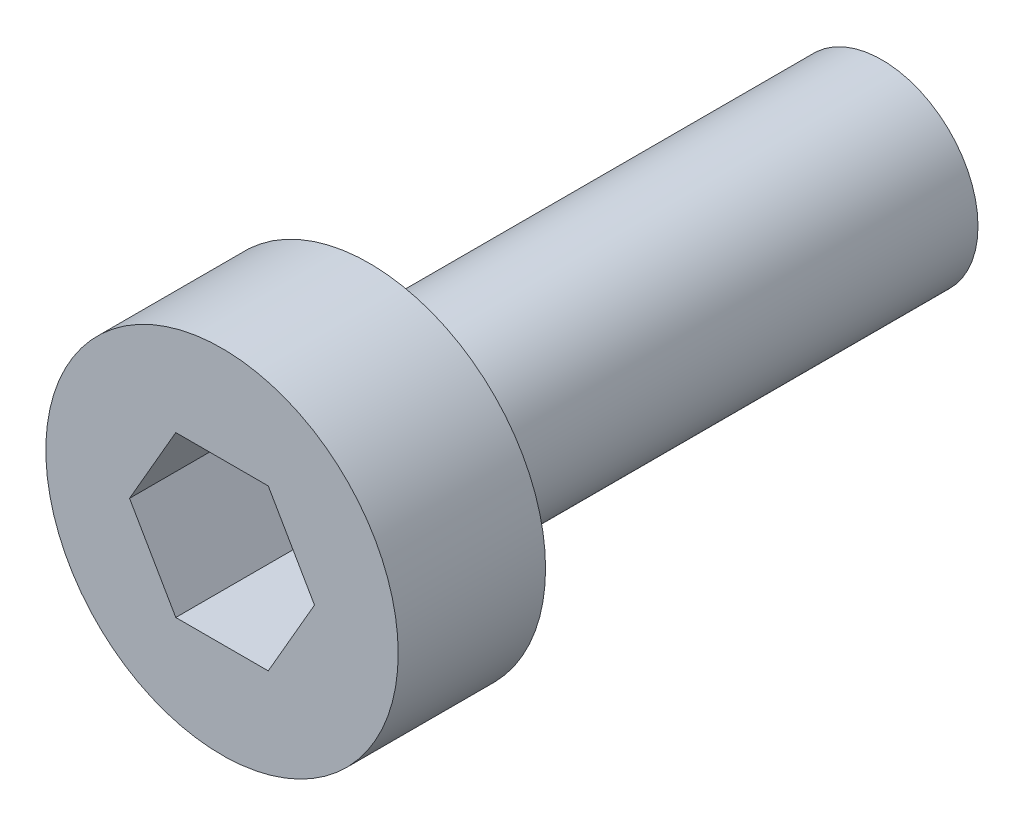
from build123d import *

# Parameters (mm, degrees)
ESQUISSE1_R             = 1.5
BOSS_EXTRU_1_DEPTH      = 8
ESQUISSE2_R             = 2.75
BOSS_EXTRU_2_DEPTH      = 2.3
ENL_V_MAT_EXTRU_1_DEPTH = 2


with BuildPart() as part:
    # Esquisse1 → Boss.-Extru.1 (new body)
    with BuildSketch(Plane.XY):
        Circle(ESQUISSE1_R)
    extrude(amount=BOSS_EXTRU_1_DEPTH)

    # Esquisse2 → Boss.-Extru.2 (add)
    with BuildSketch(Plane.XY.offset(8)):
        Circle(ESQUISSE2_R)
    extrude(amount=BOSS_EXTRU_2_DEPTH)

    # Esquisse3 → Enlèv. mat.-Extru.1 (cut)
    with BuildSketch(Plane.XY.offset(10.3)):
        Polygon((1.443375673, 0), (0.721687836, 1.25), (-0.721687836, 1.25), (-1.443375673, 0), (-0.721687836, -1.25), (0.721687836, -1.25), align=None)
    extrude(amount=-ENL_V_MAT_EXTRU_1_DEPTH, mode=Mode.SUBTRACT)


solid = part.part
